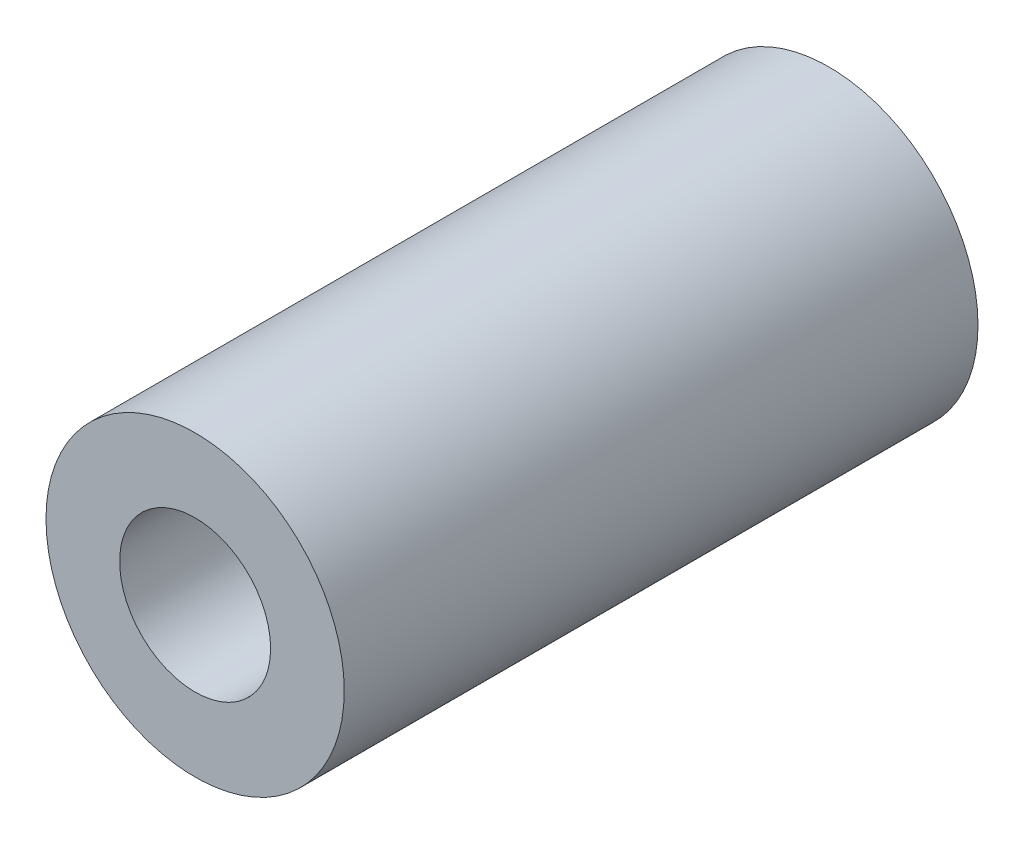
from build123d import *

# Parameters (mm, degrees)
S01_SOLID_POST_BLANK_16_MM_R             = 8
F_01_SOLID_POST_BLANK_16_MM_DEPTH        = 34
F_02_START                               = -0.1
S02_REAR_M6_HEAT_SET_INSERT_SEAT_R       = 4.05
F_02_REAR_M6_HEAT_SET_INSERT_SEAT_DEPTH  = 14.35
F_03_START                               = 19.75
S03_FRONT_M6_HEAT_SET_INSERT_SEAT_R      = 4.05
F_03_FRONT_M6_HEAT_SET_INSERT_SEAT_DEPTH = 14.35


with BuildPart() as part:
    # S01 - Solid post blank - 16 mm → 01 - Solid post blank - 16 mm (new body)
    with BuildSketch(Plane.XY):
        Circle(S01_SOLID_POST_BLANK_16_MM_R)
    extrude(amount=F_01_SOLID_POST_BLANK_16_MM_DEPTH)

    # S02 - Rear M6 heat-set insert seat → 02 - Rear M6 heat-set insert seat (cut)
    with BuildSketch(Plane.XY.offset(F_02_START)):
        Circle(S02_REAR_M6_HEAT_SET_INSERT_SEAT_R)
    extrude(amount=F_02_REAR_M6_HEAT_SET_INSERT_SEAT_DEPTH, mode=Mode.SUBTRACT)

    # S03 - Front M6 heat-set insert seat → 03 - Front M6 heat-set insert seat (cut)
    with BuildSketch(Plane.XY.offset(F_03_START)):
        Circle(S03_FRONT_M6_HEAT_SET_INSERT_SEAT_R)
    extrude(amount=F_03_FRONT_M6_HEAT_SET_INSERT_SEAT_DEPTH, mode=Mode.SUBTRACT)


solid = part.part
